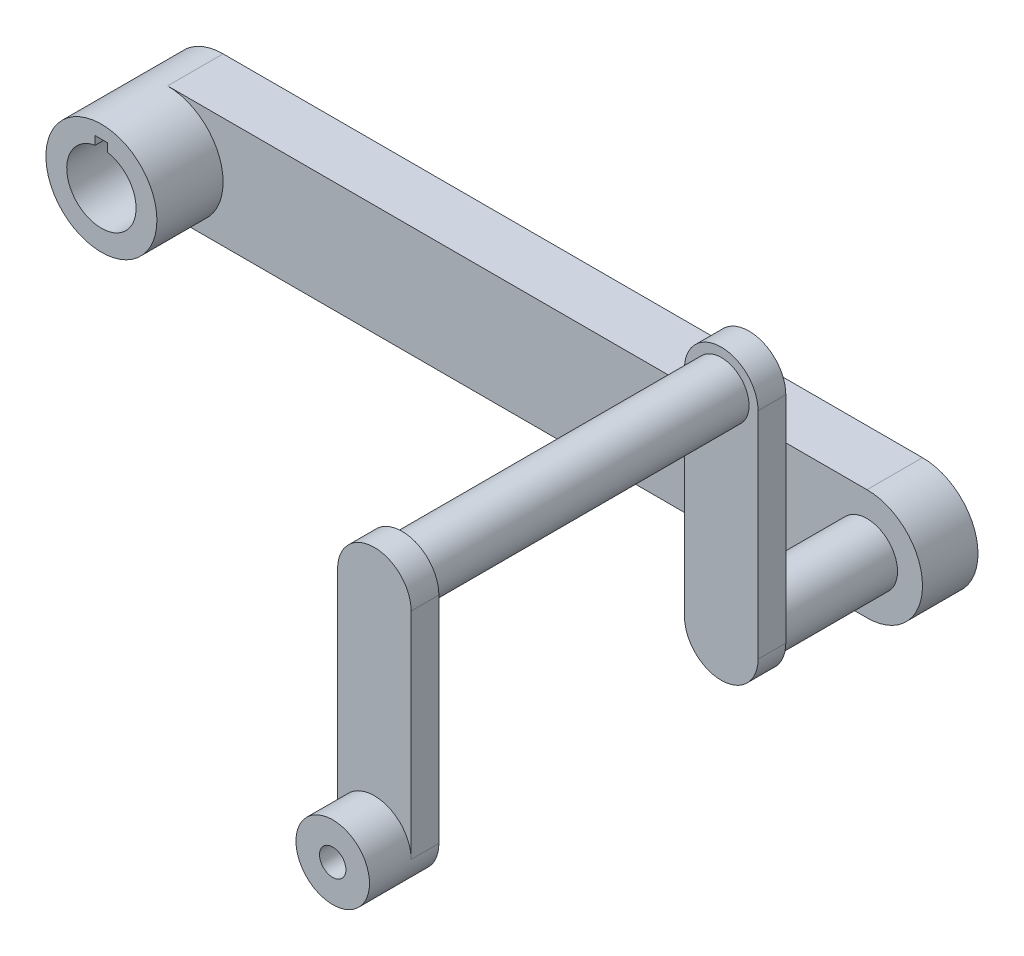
from build123d import *

# Parameters (mm, degrees)
SALIENTE_EXTRUIR1_DEPTH = 4
SALIENTE_EXTRUIR2_START = 4.77
CROQUIS2_R              = 4
SALIENTE_EXTRUIR2_DEPTH = 4.77
CROQUIS3_R              = 2.2
SALIENTE_EXTRUIR3_DEPTH = 8.5
SALIENTE_EXTRUIR4_DEPTH = 2
CROQUIS5_R              = 2
SALIENTE_EXTRUIR5_DEPTH = 23
CROQUIS6_R              = 0.95
SALIENTE_EXTRUIR6_DEPTH = 2
CROQUIS7_R              = 2.65
CROQUIS7_R_2            = 0.95
SALIENTE_EXTRUIR7_DEPTH = 3
CROQUIS8_R              = 1.25
CORTAR_EXTRUIR1_DEPTH   = 0.5


with BuildPart() as part:
    # Croquis1 → Saliente-Extruir1 (new body)
    with BuildSketch(Plane.XY):
        with BuildLine():
            Line((0, 4), (50.4, 4))
            ThreePointArc((50.4, 4), (54.4, 0), (50.4, -4))
            Line((50.4, -4), (0, -4))
            ThreePointArc((0, -4), (-4, 0), (0, 4))
        make_face()
        with BuildLine():
            Line((-0.45, 2.459166525), (-0.45, 3.059166525))
            Line((-0.45, 3.059166525), (0.45, 3.059166525))
            Line((0.45, 3.059166525), (0.45, 2.459166525))
            ThreePointArc((0.45, 2.459166525), (0, -2.5), (-0.45, 2.459166525))
        make_face(mode=Mode.SUBTRACT)
    extrude(amount=-SALIENTE_EXTRUIR1_DEPTH)

    # Croquis2 → Saliente-Extruir2 (add)
    with BuildSketch(Plane.XY.offset(SALIENTE_EXTRUIR2_START)):
        Circle(CROQUIS2_R)
        with BuildLine():
            Line((-0.45, 3.059166525), (-0.45, 2.459166525))
            ThreePointArc((-0.45, 2.459166525), (0, -2.5), (0.45, 2.459166525))
            Line((0.45, 2.459166525), (0.45, 3.059166525))
            Line((0.45, 3.059166525), (-0.45, 3.059166525))
        make_face(mode=Mode.SUBTRACT)
    extrude(amount=-SALIENTE_EXTRUIR2_DEPTH)

    # Croquis3 → Saliente-Extruir3 (add)
    with BuildSketch(Plane.XY):
        with Locations((50.4, 0)):
            Circle(CROQUIS3_R)
    extrude(amount=SALIENTE_EXTRUIR3_DEPTH)

    # Croquis4 → Saliente-Extruir4 (add)
    with BuildSketch(Plane.XY.offset(8.5)):
        with BuildLine():
            Line((47.75, 15.5), (47.75, 0))
            ThreePointArc((47.75, 0), (50.4, -2.65), (53.05, 0))
            Line((53.05, 0), (53.05, 15.5))
            ThreePointArc((53.05, 15.5), (50.4, 18.15), (47.75, 15.5))
        make_face()
    extrude(amount=SALIENTE_EXTRUIR4_DEPTH)

    # Croquis5 → Saliente-Extruir5 (add)
    with BuildSketch(Plane.XY.offset(10.5)):
        with Locations((50.4, 15.5)):
            Circle(CROQUIS5_R)
    extrude(amount=SALIENTE_EXTRUIR5_DEPTH)

    # Croquis6 → Saliente-Extruir6 (add)
    with BuildSketch(Plane.XY.offset(33.5)):
        with BuildLine():
            Line((47.75, 15.5), (47.75, 0))
            ThreePointArc((47.75, 0), (50.4, -2.65), (53.05, 0))
            Line((53.05, 0), (53.05, 15.5))
            ThreePointArc((53.05, 15.5), (50.4, 18.15), (47.75, 15.5))
        make_face()
        with Locations((50.4, 0)):
            Circle(CROQUIS6_R, mode=Mode.SUBTRACT)
    extrude(amount=SALIENTE_EXTRUIR6_DEPTH)

    # Croquis7 → Saliente-Extruir7 (add)
    with BuildSketch(Plane.XY.offset(35.5)):
        with Locations((50.4, 0)):
            Circle(CROQUIS7_R)
        with Locations((50.4, 0)):
            Circle(CROQUIS7_R_2, mode=Mode.SUBTRACT)
    extrude(amount=SALIENTE_EXTRUIR7_DEPTH)

    # Croquis8 → Cortar-Extruir1 (cut)
    with BuildSketch(Plane(origin=(0, 0, 33.5), x_dir=(-1, 0, 0), z_dir=(0, 0, -1))):
        with Locations((-50.4, 0)):
            Circle(CROQUIS8_R)
    extrude(amount=-CORTAR_EXTRUIR1_DEPTH, mode=Mode.SUBTRACT)


solid = part.part
